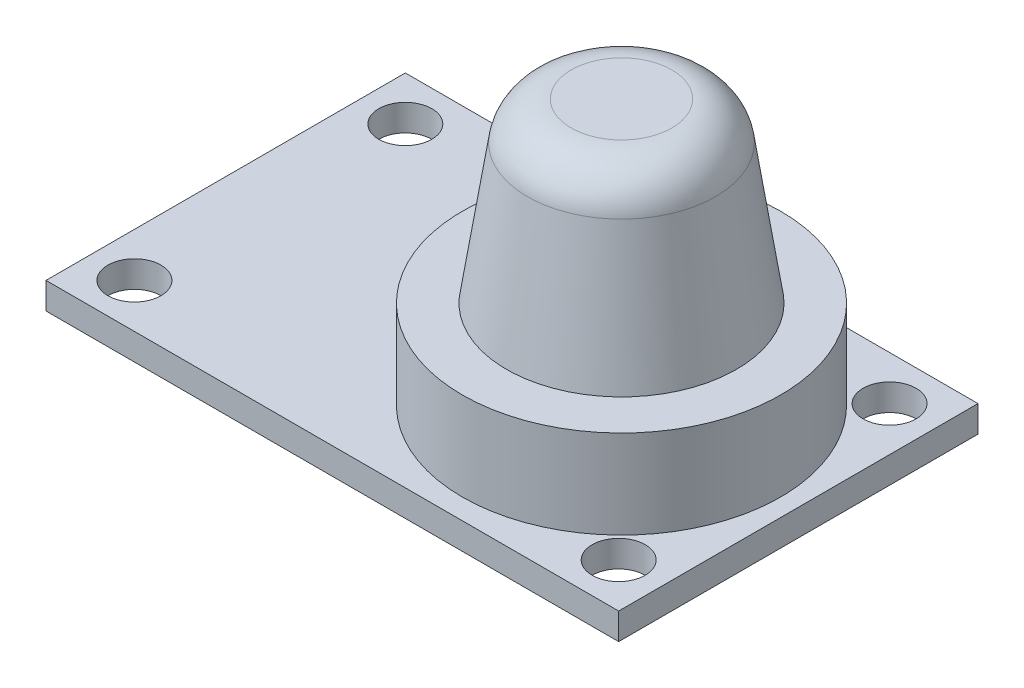
from build123d import *

# Parameters (mm, degrees)
SKETCH1_W           = 32.385
SKETCH1_H           = 20.32
SKETCH1_R           = 1.5
BOSS_EXTRUDE1_DEPTH = 1.5
SKETCH2_R           = 9
BOSS_EXTRUDE2_DEPTH = 5


with BuildPart() as part:
    # Sketch1 → Boss-Extrude1 (new body)
    with BuildSketch(Plane(origin=(0, 0, 0), x_dir=(1, 0, 0), z_dir=(0, 1, 0))):
        Rectangle(SKETCH1_W, SKETCH1_H)
        with Locations(Location((-13.6925, 7.66, 0), (0, 0, 270))):
            Circle(SKETCH1_R, mode=Mode.SUBTRACT)
        with Locations(Location((13.6925, 7.66, 0), (0, 0, 90))):
            Circle(SKETCH1_R, mode=Mode.SUBTRACT)
        with Locations(Location((13.6925, -7.66, 0), (0, 0, 270))):
            Circle(SKETCH1_R, mode=Mode.SUBTRACT)
        with Locations(Location((-13.6925, -7.66, 0), (0, 0, 90))):
            Circle(SKETCH1_R, mode=Mode.SUBTRACT)
    extrude(amount=BOSS_EXTRUDE1_DEPTH)

    # Sketch2 → Boss-Extrude2 (add)
    with BuildSketch(Plane(origin=(0, 1.5, 0), x_dir=(1, 0, 0), z_dir=(0, 1, 0))):
        with Locations(Location((6.1925, 0, 0), (0, 0, 270))):
            Circle(SKETCH2_R)
    extrude(amount=BOSS_EXTRUDE2_DEPTH)

    # Sketch3 → Revolve1 (revolve)
    with BuildSketch(Plane.XY, mode=Mode.PRIVATE) as revolve1_sk:
        with BuildLine():
            Line((6.1925, 6.5), (6.1925, 16.5))
            Line((6.1925, 16.5), (9.039531448, 16.5))
            ThreePointArc((9.039531448, 16.5), (10.670922292, 15.894350526), (11.51187233, 14.370851132))
            Line((11.51187233, 14.370851132), (12.6925, 6.5))
            Line((12.6925, 6.5), (6.1925, 6.5))
        make_face()
    revolve(revolve1_sk.sketch.rotate(Axis((6.1925, 6.5, 0), (0, 1, 0)), 90), axis=Axis((6.1925, 6.5, 0), (0, 1, 0)))


solid = part.part
